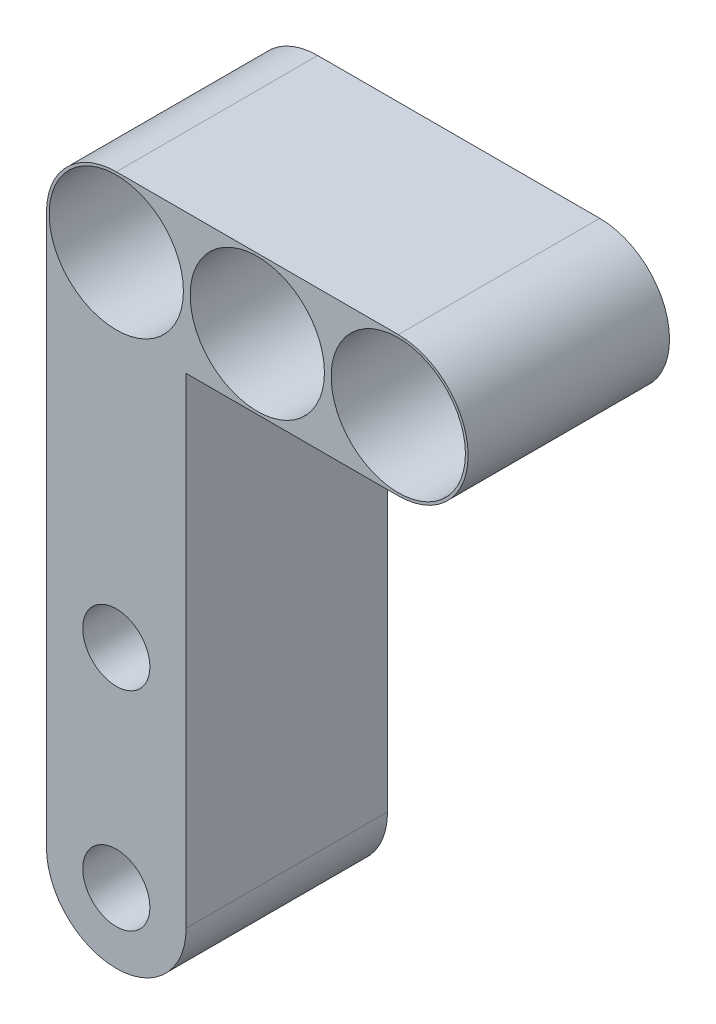
from build123d import *

# Parameters (mm, degrees)
SKETCH1_R           = 0.52
SKETCH1_R_2         = 0.5
SKETCH1_R_3         = 0.25
BOSS_EXTRUDE1_DEPTH = 1.5


with BuildPart() as part:
    # Sketch1 → Boss-Extrude1 (new body)
    # profile 1 of 8: a face of its own
    with BuildSketch(Plane.XY):
        with BuildLine():
            ThreePointArc((0.52, 0), (0, -0.52), (-0.52, 0))
            Line((-0.52, 0), (-0.52, -2.548388303))
            ThreePointArc((-0.52, -2.548388303), (0, -2.028388303), (0.52, -2.548388303))
            Line((0.52, -2.548388303), (0.52, -0.52))
            Line((0.52, -0.52), (1.05, -0.52))
            ThreePointArc((1.05, -0.52), (0.53, 0), (1.05, 0.52))
            Line((1.05, 0.52), (0, 0.52))
            ThreePointArc((0, 0.52), (0.367695526, 0.367695526), (0.52, 0))
        make_face()
    # profile 2 of 8: a face of its own
    with BuildSketch(Plane.XY):
        with BuildLine():
            Line((2.1, 0.52), (1.05, 0.52))
            ThreePointArc((1.05, 0.52), (1.417695526, 0.367695526), (1.57, 0))
            ThreePointArc((1.57, 0), (1.417695526, -0.367695526), (1.05, -0.52))
            Line((1.05, -0.52), (2.1, -0.52))
            ThreePointArc((2.1, -0.52), (1.58, 0), (2.1, 0.52))
        make_face()
    # profile 3 of 8: a face of its own
    with BuildSketch(Plane.XY):
        with Locations((2.1, 0)):
            Circle(SKETCH1_R)
        with Locations((2.1, 0)):
            Circle(SKETCH1_R_2, mode=Mode.SUBTRACT)
    # profile 4 of 8: a face of its own
    with BuildSketch(Plane.XY):
        Circle(SKETCH1_R)
        Circle(SKETCH1_R_2, mode=Mode.SUBTRACT)
    # profile 5 of 8: a face of its own
    with BuildSketch(Plane.XY):
        with Locations((1.05, 0)):
            Circle(SKETCH1_R)
        with Locations((1.05, 0)):
            Circle(SKETCH1_R_2, mode=Mode.SUBTRACT)
    # profile 6 of 8: a face of its own
    with BuildSketch(Plane.XY):
        with BuildLine():
            ThreePointArc((0.52, -2.548388303), (0, -3.068388303), (-0.52, -2.548388303))
            Line((-0.52, -2.548388303), (-0.52, -4.098388303))
            ThreePointArc((-0.52, -4.098388303), (0, -3.578388303), (0.52, -4.098388303))
            Line((0.52, -4.098388303), (0.52, -2.548388303))
        make_face()
    # profile 7 of 8: a face of its own
    with BuildSketch(Plane.XY):
        with Locations((0, -2.548388303)):
            Circle(SKETCH1_R)
        with Locations((0, -2.548388303)):
            Circle(SKETCH1_R_3, mode=Mode.SUBTRACT)
    # profile 8 of 8: a face of its own
    with BuildSketch(Plane.XY):
        with Locations((0, -4.098388303)):
            Circle(SKETCH1_R)
        with Locations((0, -4.098388303)):
            Circle(SKETCH1_R_3, mode=Mode.SUBTRACT)
    extrude(amount=BOSS_EXTRUDE1_DEPTH)


solid = part.part
